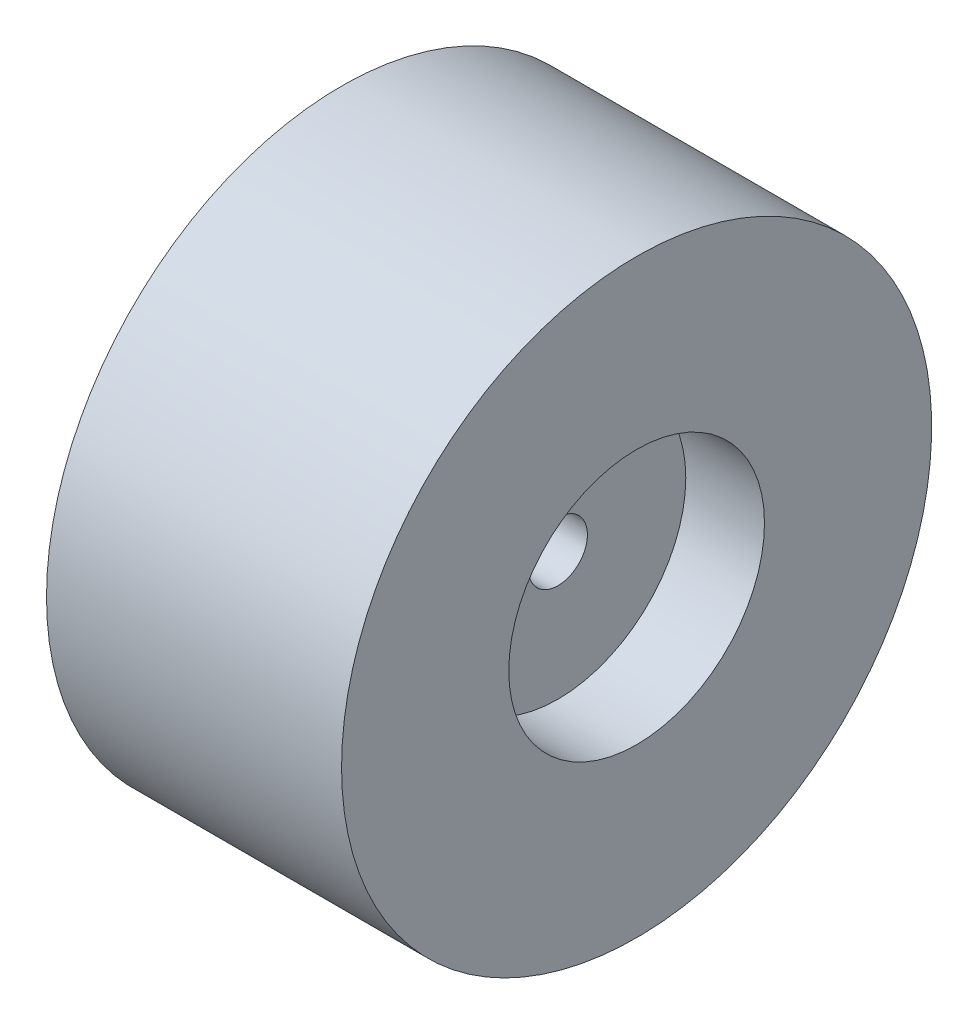
from build123d import *


with BuildPart() as part:
    # Эскиз4 → Повернуть1 (revolve)
    with BuildSketch(Plane.XY, mode=Mode.PRIVATE) as revolve_1_sk:
        Polygon((-30, 30), (-30, 25.082903769), (-28, 23.082903769), (-14, 15), (-14, 3), (-8, 3), (-8, 13), (0, 13), (0, 30), align=None)
    revolve(revolve_1_sk.sketch.rotate(Axis((-30, 0, 0), (1, 0, 0)), 90), axis=Axis((-30, 0, 0), (1, 0, 0)))


solid = part.part
